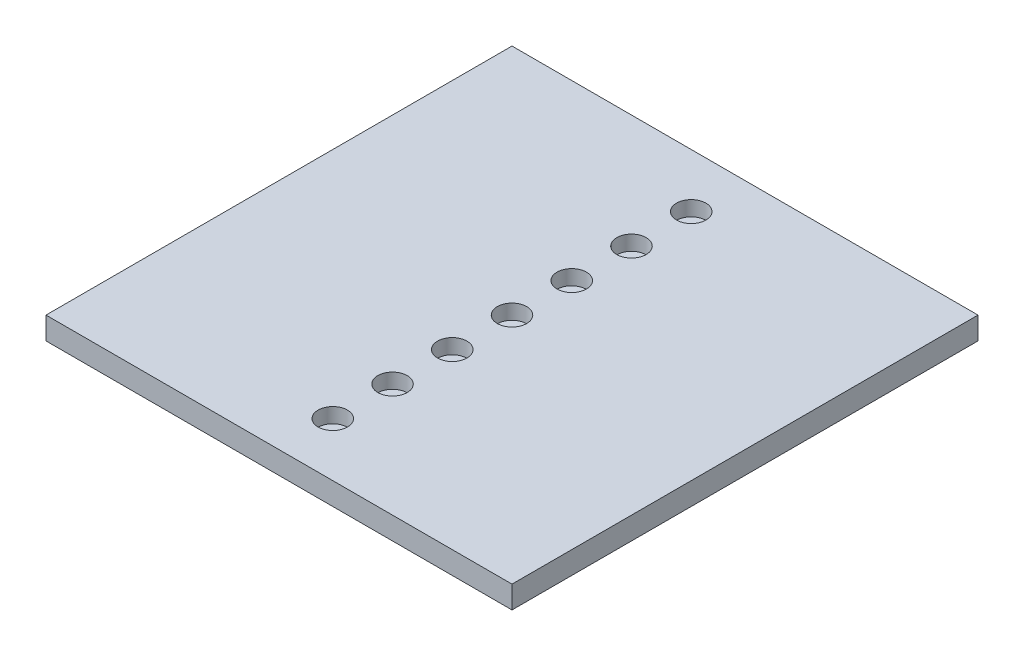
from build123d import *

# Parameters (mm, degrees)
SKETCH2_W         = 396.24
SKETCH2_H         = 396.24
SKETCH2_R         = 3.3782
BOLT_HOLES_DEPTH  = 19.05
SKETCH3_R         = 12.5
COUNTERBORE_DEPTH = 12.7


with BuildPart() as part:
    # Sketch2 → Bolt Holes (new body)
    with BuildSketch(Plane(origin=(0, 0, 0), x_dir=(1, 0, 0), z_dir=(0, 1, 0))):
        Rectangle(SKETCH2_W, SKETCH2_H)
        with Locations(Location((0, 0, 0), (0, 0, 90))):
            Circle(SKETCH2_R, mode=Mode.SUBTRACT)
        with Locations(Location((0, 50.8, 0), (0, 0, 90))):
            Circle(SKETCH2_R, mode=Mode.SUBTRACT)
        with Locations(Location((0, 101.6, 0), (0, 0, 90))):
            Circle(SKETCH2_R, mode=Mode.SUBTRACT)
        with Locations(Location((0, 152.4, 0), (0, 0, 90))):
            Circle(SKETCH2_R, mode=Mode.SUBTRACT)
        with Locations(Location((0, -50.8, 0), (0, 0, 90))):
            Circle(SKETCH2_R, mode=Mode.SUBTRACT)
        with Locations(Location((0, -101.6, 0), (0, 0, 90))):
            Circle(SKETCH2_R, mode=Mode.SUBTRACT)
        with Locations(Location((0, -152.4, 0), (0, 0, 90))):
            Circle(SKETCH2_R, mode=Mode.SUBTRACT)
    extrude(amount=BOLT_HOLES_DEPTH)

    # Sketch3 → Counterbore (cut)
    with BuildSketch(Plane(origin=(0, 19.05, 0), x_dir=(1, 0, 0), z_dir=(0, 1, 0))):
        with Locations(Location((0, -50.8, 0), (0, 0, 270))):
            Circle(SKETCH3_R)
        with Locations(Location((0, 0, 0), (0, 0, 270))):
            Circle(SKETCH3_R)
        with Locations(Location((0, -101.6, 0), (0, 0, 270))):
            Circle(SKETCH3_R)
        with Locations(Location((0, 50.8, 0), (0, 0, 270))):
            Circle(SKETCH3_R)
        with Locations(Location((0, 101.6, 0), (0, 0, 270))):
            Circle(SKETCH3_R)
        with Locations(Location((0, 152.4, 0), (0, 0, 270))):
            Circle(SKETCH3_R)
        with Locations(Location((0, -152.4, 0), (0, 0, 270))):
            Circle(SKETCH3_R)
    extrude(amount=-COUNTERBORE_DEPTH, mode=Mode.SUBTRACT)


solid = part.part
